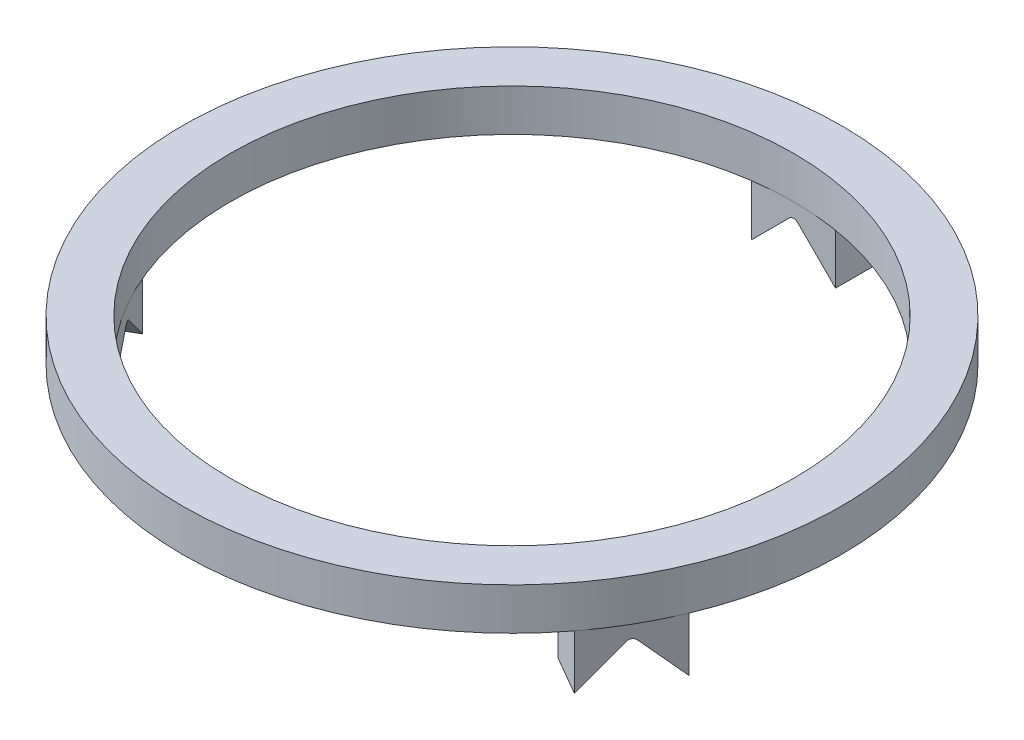
from build123d import *

# Parameters (mm, degrees)
SKETCH1_R                = 13.97
SKETCH1_R_2              = 11.938
BOSS_EXTRUDE1_DEPTH      = 1.778
BOSS_EXTRUDE2_DEPTH      = 2.286
CUT_EXTRUDE1_DEPTH       = 2.54
FILLET2_R                = 0.254
CIRPATTERN2_COUNT        = 3
FILLET2_OF_CIRPATTERN2_R = 0.254


with BuildPart() as part:
    # Sketch1 → Boss-Extrude1 (new body)
    with BuildSketch(Plane(origin=(0, 0, 0), x_dir=(1, 0, 0), z_dir=(0, 1, 0))):
        with Locations(Location((0, 0, 0), (0, 0, 270))):
            Circle(SKETCH1_R)
        with Locations(Location((0, 0, 0), (0, 0, 270))):
            Circle(SKETCH1_R_2, mode=Mode.SUBTRACT)
    extrude(amount=BOSS_EXTRUDE1_DEPTH)

    # Sketch3 → Boss-Extrude2 (add)
    with BuildSketch(Plane(origin=(0, 0, 0), x_dir=(-1, 0, 0), z_dir=(0, -1, 0))):
        Polygon((0, 11.938), (-1.778, 11.938), (-1.778, 13.856392604), (1.778, 13.856392604), (1.778, 11.938), align=None)
    boss_extrude2 = extrude(amount=BOSS_EXTRUDE2_DEPTH)

    # Sketch4 → Cut-Extrude1 (cut)
    with BuildSketch(Plane.XY.offset(-11.938)):
        Polygon((-1.778, -2.286), (0, -0.508), (1.778, -2.286), align=None)
    cut_extrude1 = extrude(amount=-CUT_EXTRUDE1_DEPTH, mode=Mode.SUBTRACT)

    # Fillet2
    fillet2_edges = [part.edges().sort_by_distance(p)[0] for p in [
        (0, -0.508, -12.897196302),
    ]]
    fillet(fillet2_edges, radius=FILLET2_R)

    # CirPattern2: Boss-Extrude2, Cut-Extrude1 ×3 about axis
    cirpattern2_axis = Axis((0, 0, 0), (0, 1, 0))
    add([boss_extrude2.rotate(cirpattern2_axis, i * 360 / CIRPATTERN2_COUNT) for i in range(1, CIRPATTERN2_COUNT)])
    add([cut_extrude1.rotate(cirpattern2_axis, i * 360 / CIRPATTERN2_COUNT) for i in range(1, CIRPATTERN2_COUNT)], mode=Mode.SUBTRACT)

    # Fillet2 of CirPattern2
    fillet2_of_cirpattern2_edges = [part.edges().sort_by_distance(p)[0] for p in [
        (-11.169299635, -0.508, 6.448598151),
        (11.169299635, -0.508, 6.448598151),
    ]]
    fillet(fillet2_of_cirpattern2_edges, radius=FILLET2_OF_CIRPATTERN2_R)


solid = part.part
